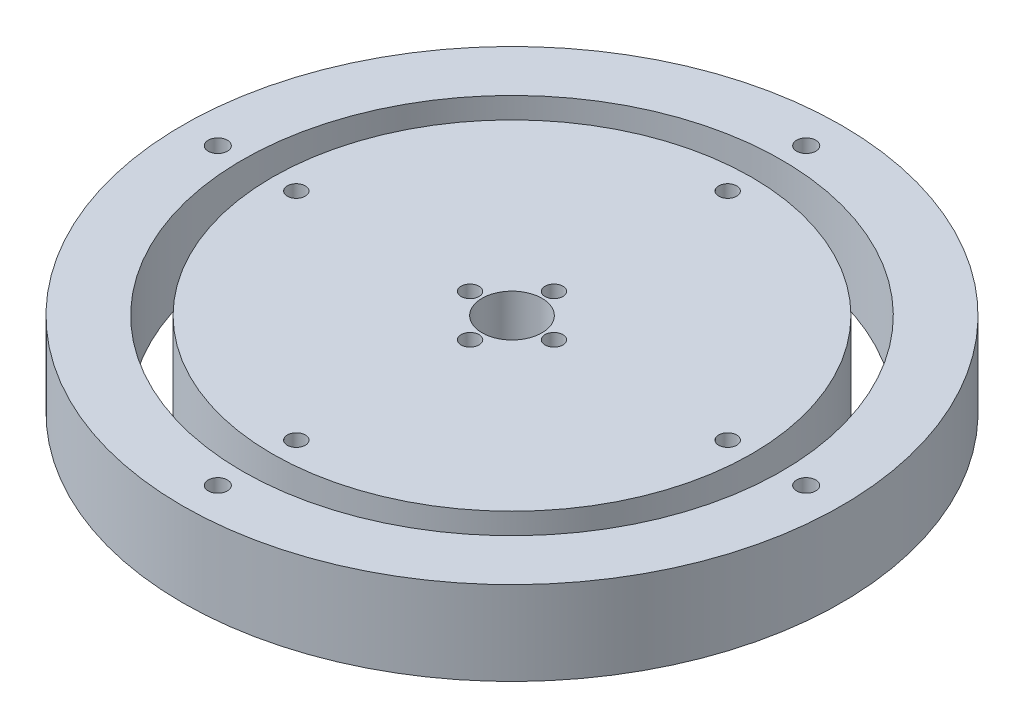
from build123d import *

# Parameters (mm, degrees)
SKETCH_1_R        = 55
SKETCH_1_R_2      = 1.6
SKETCH_1_R_3      = 45
EXTRUDE_9_DEPTH   = 14
SKETCH_1_R_4      = 40
SKETCH_1_R_5      = 1.5
SKETCH_1_R_6      = 5
EXTRUDE_9_2_DEPTH = 14


with BuildPart() as part:
    # 草图1 → 凸台-拉伸9 (new body)
    with BuildSketch(Plane(origin=(0, 0, 0), x_dir=(1, 0, 0), z_dir=(0, 1, 0))):
        with Locations(Location((0, 0, 0), (0, 0, 270))):
            Circle(SKETCH_1_R)
        with Locations(Location((0, -49.1, 0), (0, 0, 270))):
            Circle(SKETCH_1_R_2, mode=Mode.SUBTRACT)
        with Locations(Location((0, 49.1, 0), (0, 0, 270))):
            Circle(SKETCH_1_R_2, mode=Mode.SUBTRACT)
        with Locations(Location((49.1, 0, 0), (0, 0, 270))):
            Circle(SKETCH_1_R_2, mode=Mode.SUBTRACT)
        with Locations(Location((-49.1, 0, 0), (0, 0, 270))):
            Circle(SKETCH_1_R_2, mode=Mode.SUBTRACT)
        with Locations(Location((0, 0, 0), (0, 0, 270))):
            Circle(SKETCH_1_R_3, mode=Mode.SUBTRACT)
    extrude(amount=EXTRUDE_9_DEPTH)


with BuildPart() as body_2:
    # 草图1 → Extrude 9 2 (new body)
    with BuildSketch(Plane(origin=(0, 0, 0), x_dir=(1, 0, 0), z_dir=(0, 1, 0))):
        with Locations(Location((0, 0, 0), (0, 0, 270))):
            Circle(SKETCH_1_R_4)
        with Locations(Location((0, -36, 0), (0, 0, 270))):
            Circle(SKETCH_1_R_5, mode=Mode.SUBTRACT)
        with Locations(Location((0, 36, 0), (0, 0, 270))):
            Circle(SKETCH_1_R_5, mode=Mode.SUBTRACT)
        with Locations(Location((36, 0, 0), (0, 0, 270))):
            Circle(SKETCH_1_R_5, mode=Mode.SUBTRACT)
        with Locations(Location((-36, 0, 0), (0, 0, 270))):
            Circle(SKETCH_1_R_5, mode=Mode.SUBTRACT)
        with Locations(Location((0, -7, 0), (0, 0, 270))):
            Circle(SKETCH_1_R_5, mode=Mode.SUBTRACT)
        with Locations(Location((-7, 0, 0), (0, 0, 270))):
            Circle(SKETCH_1_R_5, mode=Mode.SUBTRACT)
        with Locations(Location((0, 7, 0), (0, 0, 270))):
            Circle(SKETCH_1_R_5, mode=Mode.SUBTRACT)
        with Locations(Location((7, 0, 0), (0, 0, 270))):
            Circle(SKETCH_1_R_5, mode=Mode.SUBTRACT)
        with Locations(Location((0, 0, 0), (0, 0, 270))):
            Circle(SKETCH_1_R_6, mode=Mode.SUBTRACT)
    extrude(amount=EXTRUDE_9_2_DEPTH)


solid = Compound([part.part, body_2.part])
